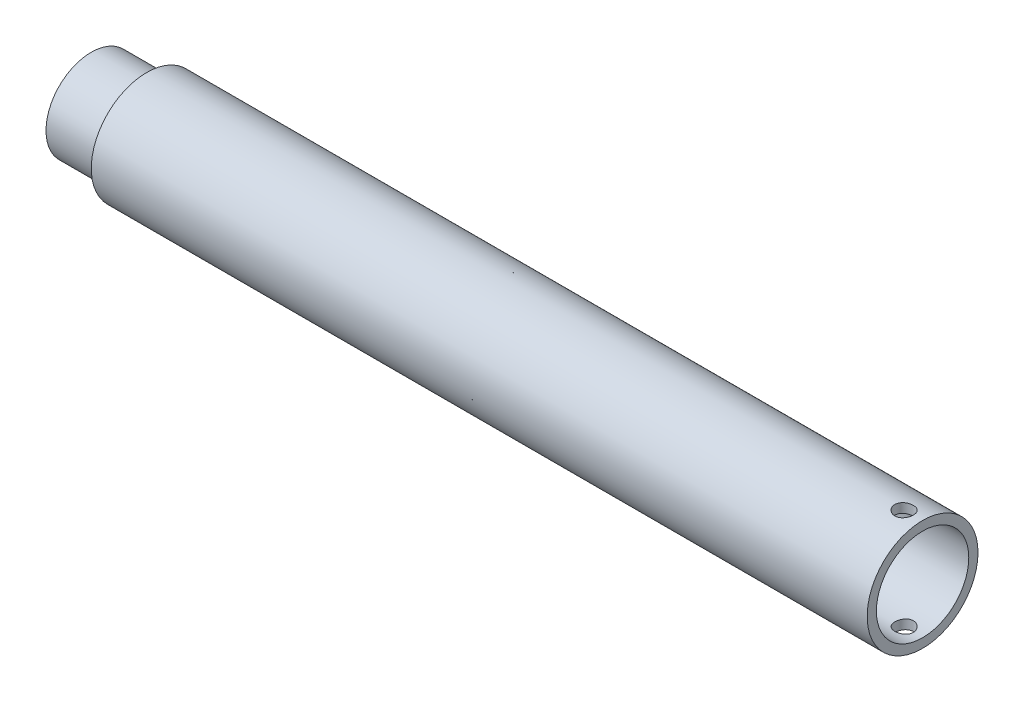
from build123d import *

# Parameters (mm, degrees)
ESBO_O1_R                  = 15
ESBO_O1_R_2                = 12.5
RESSALTO_EXTRUS_O1_DEPTH   = 210
RESSALTO_EXTRUS_O3_START   = 15
ESBO_O2_R                  = 12.25
ESBO_O2_R_2                = 10
RESSALTO_EXTRUS_O3_DEPTH   = 20
CORTE_EXTRUS_O2_DEPTH      = 300
CORTE_EXTRUS_O2_DEPTH_BACK = 300
ESBO_O4_R                  = 2.5
ESBO_O9_R                  = 12.5
RESSALTO_EXTRUS_O5_DEPTH   = 10
ESBO_O10_R                 = 10
CORTE_EXTRUS_O5_DEPTH      = 20


with BuildPart() as part:
    # Esboço1 → Ressalto-extrusão1 (new body)
    with BuildSketch(Plane(origin=(0, 0, 0), x_dir=(0, 0, -1), z_dir=(1, 0, 0))):
        Circle(ESBO_O1_R)
        Circle(ESBO_O1_R_2, mode=Mode.SUBTRACT)
    extrude(amount=RESSALTO_EXTRUS_O1_DEPTH)

    # Esboço4 → Corte-extrusão2 (cut, two sides: drawn at the far end of the back side and taken through both)
    with BuildSketch(Plane(origin=(0, 0, 0), x_dir=(1, 0, 0), z_dir=(0, 1, 0)).offset(-CORTE_EXTRUS_O2_DEPTH_BACK)):
        with Locations((205, 0)):
            Circle(ESBO_O4_R)
    extrude(amount=CORTE_EXTRUS_O2_DEPTH + CORTE_EXTRUS_O2_DEPTH_BACK, mode=Mode.SUBTRACT)



with BuildPart() as body_2:
    # Esboço2 → Ressalto-extrusão3 (new body)
    with BuildSketch(Plane.ZY.offset(RESSALTO_EXTRUS_O3_START)):
        Circle(ESBO_O2_R)
        Circle(ESBO_O2_R_2, mode=Mode.SUBTRACT)
    extrude(amount=-RESSALTO_EXTRUS_O3_DEPTH)


with BuildPart() as part_1:
    add(part.part)

    add(body_2.part)  # Ressalto-extrusão5 merges body 2
    # Esboço9 → Ressalto-extrusão5 (add)
    with BuildSketch(Plane.ZY):
        Circle(ESBO_O9_R)
    extrude(amount=-RESSALTO_EXTRUS_O5_DEPTH)

    # Esboço10 → Corte-extrusão5 (cut)
    with BuildSketch(Plane.ZY):
        Circle(ESBO_O10_R)
    extrude(amount=-CORTE_EXTRUS_O5_DEPTH, mode=Mode.SUBTRACT)


solid = part_1.part
